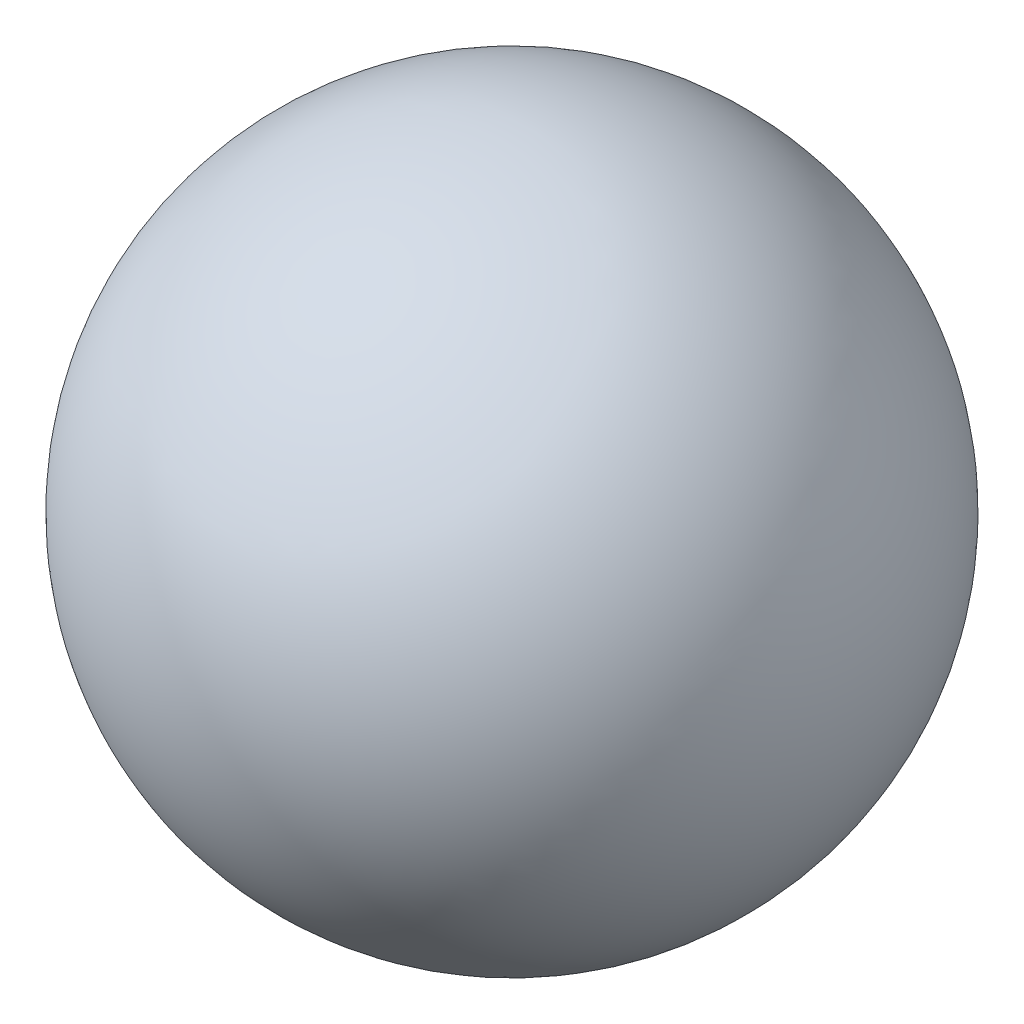
from build123d import *
from build123d.topology import SkipClean


with BuildPart() as part:
    # Sketch1 → Revolve2 (revolve)
    with SkipClean():  # the faces are left unmerged after this step: merging them gives an invalid solid
        with BuildSketch(Plane(origin=(0, 0, 0), x_dir=(1, 0, 0), z_dir=(0, 1, 0))):
            with BuildLine():
                ThreePointArc((3.81, 0), (2.694076836, 2.694076836), (0, 3.81))
                Line((0, 3.81), (0, -3.81))
                ThreePointArc((0, -3.81), (2.694076836, -2.694076836), (3.81, 0))
            make_face()
            with BuildLine():
                Line((0, -3.81), (0, 3.81))
                ThreePointArc((0, 3.81), (-3.81, 0), (0, -3.81))
            make_face()
        revolve(axis=Axis((0, 0, -3.81), (0, 0, 1)))


solid = part.part
